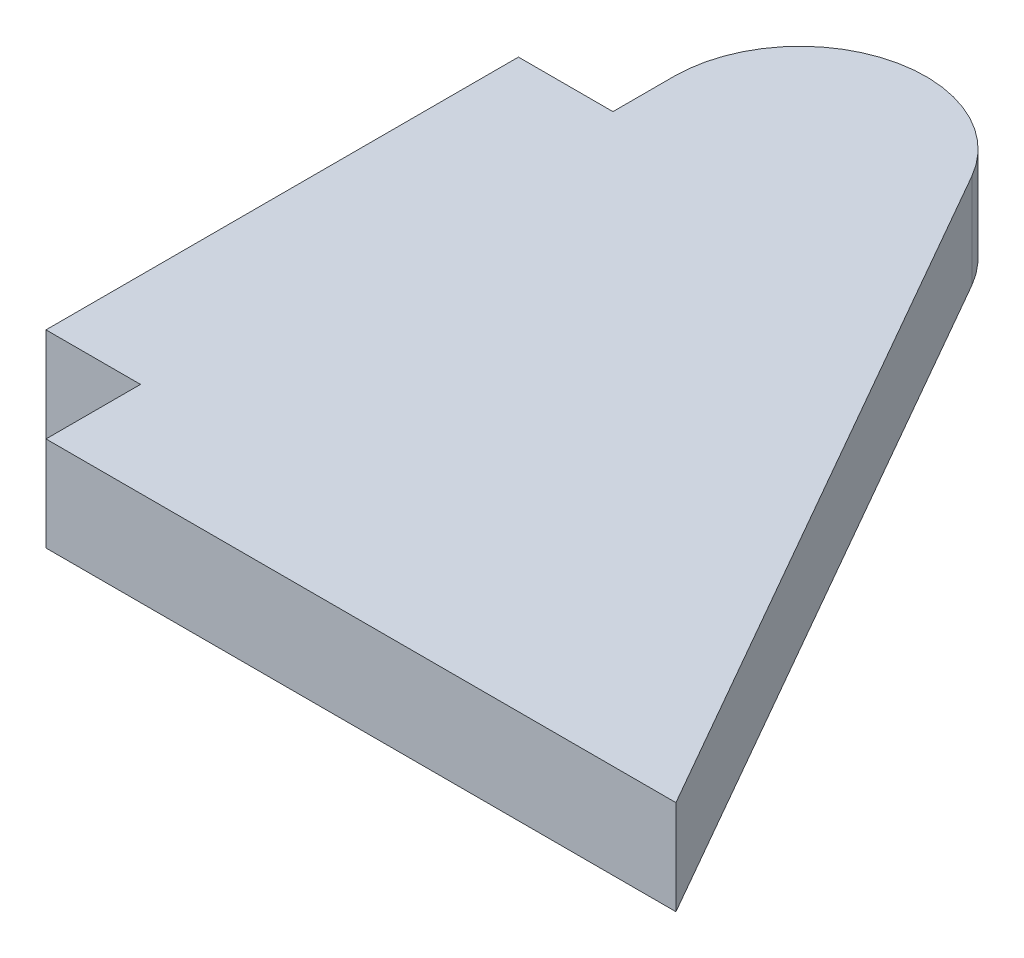
from build123d import *

# Parameters (mm, degrees)
BOSS_EXTRUDE1_DEPTH = 1.5
SKETCH2_W           = 3
SKETCH2_H           = 15
BOSS_EXTRUDE2_DEPTH = 1.5
FILLET1_R           = 4


with BuildPart() as part:
    # Sketch1 → Boss-Extrude1 (new, symmetric)
    with BuildSketch(Plane(origin=(0, 0, 0), x_dir=(1, 0, 0), z_dir=(0, 1, 0))):
        Polygon((-10, 17.5), (10, -17.5), (-10, -17.5), align=None)
    extrude(amount=BOSS_EXTRUDE1_DEPTH, both=True)

    # Sketch2 → Boss-Extrude2 (add, symmetric)
    with BuildSketch(Plane(origin=(0, 0, 0), x_dir=(1, 0, 0), z_dir=(0, 1, 0))):
        with Locations((-11.5, -7)):
            Rectangle(SKETCH2_W, SKETCH2_H)
    extrude(amount=BOSS_EXTRUDE2_DEPTH, both=True)

    # Fillet1
    fillet1_edges = [part.edges().sort_by_distance(p)[0] for p in [
        (-10, 0, -17.5),
    ]]
    fillet(fillet1_edges, radius=FILLET1_R)


solid = part.part
